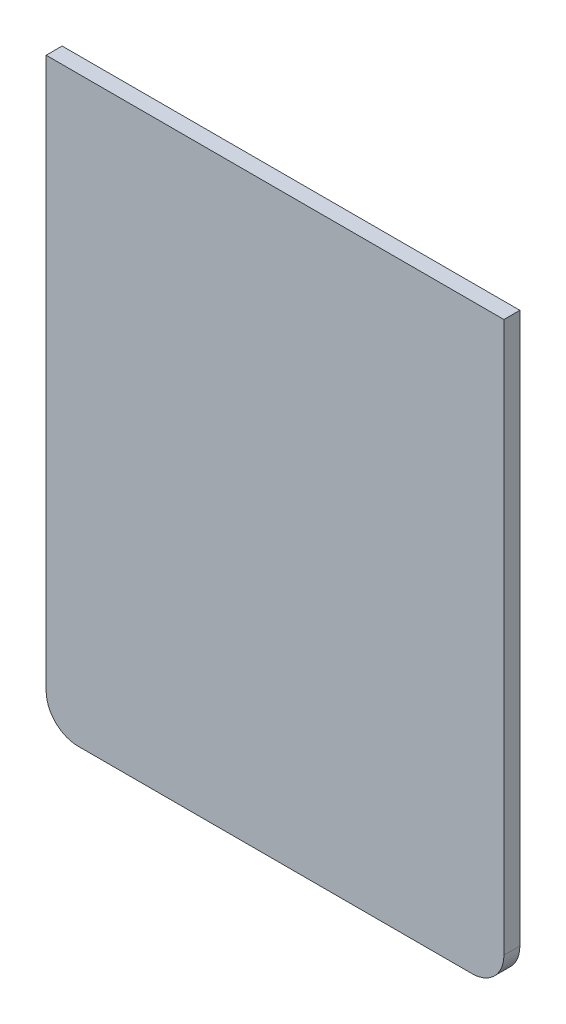
from build123d import *

# Parameters (mm, degrees)
BOSS_EXTRUDE1_DEPTH = 6.35


with BuildPart() as part:
    # Sketch1 → Boss-Extrude1 (new body)
    with BuildSketch(Plane.XY):
        with BuildLine():
            Line((-19.05, 903.02716301), (163.099999994, 903.02716301))
            Line((163.099999994, 903.02716301), (163.099999994, 683.95216301))
            ThreePointArc((163.099999994, 683.95216301), (159.380256115, 674.971906889), (150.399999994, 671.25216301))
            Line((150.399999994, 671.25216301), (-6.35, 671.25216301))
            ThreePointArc((-6.35, 671.25216301), (-15.330256121, 674.971906889), (-19.05, 683.95216301))
            Line((-19.05, 683.95216301), (-19.05, 903.02716301))
        make_face()
    extrude(amount=BOSS_EXTRUDE1_DEPTH)


solid = part.part
